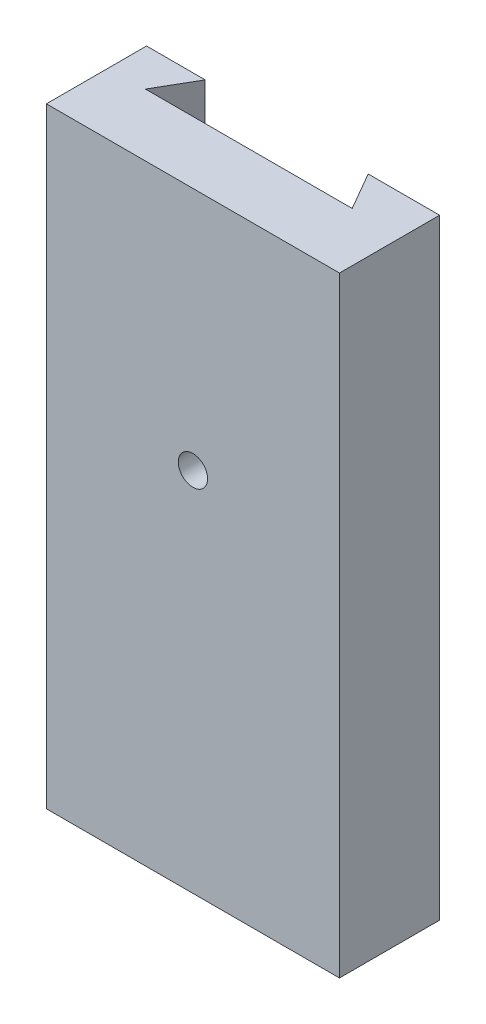
from build123d import *

# Parameters (mm, degrees)
SKETCH1_W           = 120
SKETCH1_H           = 41
BOSS_EXTRUDE1_DEPTH = 250
CUT_EXTRUDE1_DEPTH  = 250
SKETCH3_R           = 6
CUT_EXTRUDE2_DEPTH  = 250


with BuildPart() as part:
    # Sketch1 → Boss-Extrude1 (new body)
    with BuildSketch(Plane(origin=(0, 0, 0), x_dir=(1, 0, 0), z_dir=(0, 1, 0))):
        Rectangle(SKETCH1_W, SKETCH1_H)
    extrude(amount=BOSS_EXTRUDE1_DEPTH)

    # Sketch2 → Cut-Extrude1 (cut)
    with BuildSketch(Plane(origin=(0, 250, 0), x_dir=(1, 0, 0), z_dir=(0, 1, 0))):
        Polygon((-36, 20.5), (-44.948929172, 5), (39.708929172, 5), (30.76, 20.5), align=None)
    extrude(amount=-CUT_EXTRUDE1_DEPTH, mode=Mode.SUBTRACT)

    # Sketch3 → Cut-Extrude2 (cut)
    with BuildSketch(Plane.XY.offset(20.5)):
        with Locations((0, 150)):
            Circle(SKETCH3_R)
    extrude(amount=-CUT_EXTRUDE2_DEPTH, mode=Mode.SUBTRACT)


solid = part.part
